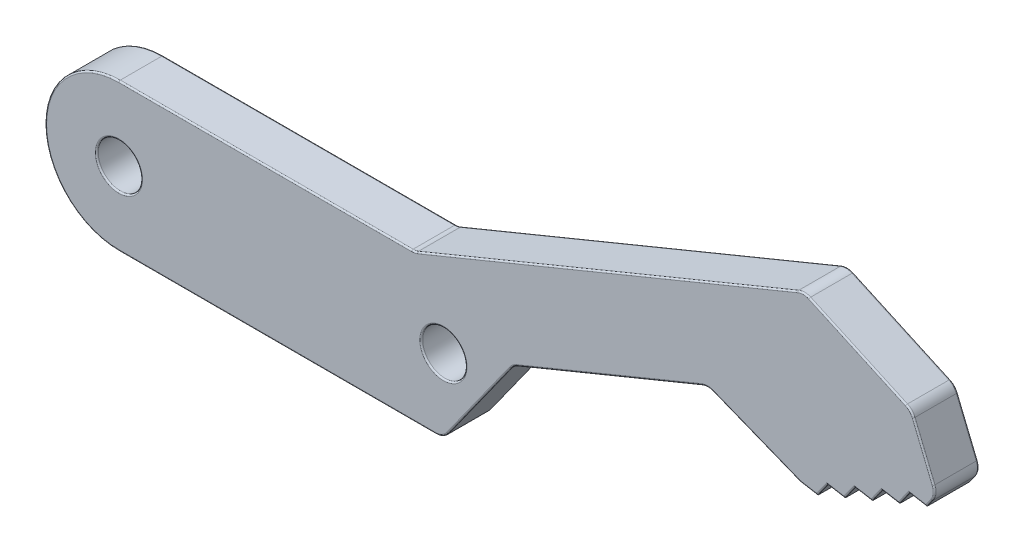
from build123d import *

# Parameters (mm, degrees)
SKETCH1_R           = 1.5
BOSS_EXTRUDE1_DEPTH = 3
FILLET1_R           = 1
FILLET2_R           = 0.1


with BuildPart() as part:
    # Sketch1 → Boss-Extrude1 (new body)
    with BuildSketch(Plane.XY):
        with BuildLine():
            Line((20.05, 5), (0, 5))
            ThreePointArc((0, 5), (-5, 0), (0, -5))
            Line((0, -5), (22, -5))
            Line((22, -5), (26.72989842, 1.621129525))
            Line((26.72989842, 1.621129525), (39.900164389, 7.036080522))
            Line((39.900164389, 7.036080522), (46.188488025, 4.540007042))
            Line((46.188488025, 4.540007042), (47.352932204, 4.337597171))
            Line((47.352932204, 4.337597171), (48.038244482, 5.300533868))
            Line((48.038244482, 5.300533868), (49.20268866, 5.098123997))
            Line((49.20268866, 5.098123997), (49.888000938, 6.061060693))
            Line((49.888000938, 6.061060693), (51.052445116, 5.858650822))
            Line((51.052445116, 5.858650822), (51.737757394, 6.821587519))
            Line((51.737757394, 6.821587519), (52.902201573, 6.619177648))
            Line((52.902201573, 6.619177648), (53.587513851, 7.582114344))
            Line((53.587513851, 7.582114344), (54.751958029, 7.379704473))
            Line((54.751958029, 7.379704473), (55.437270307, 8.34264117))
            Line((55.437270307, 8.34264117), (53.72608495, 12.504593197))
            Line((53.72608495, 12.504593197), (46.409029503, 15.837507263))
            Line((46.409029503, 15.837507263), (20.05, 5))
        make_face()
        Circle(SKETCH1_R, mode=Mode.SUBTRACT)
        with Locations((22, 0)):
            Circle(SKETCH1_R, mode=Mode.SUBTRACT)
    extrude(amount=BOSS_EXTRUDE1_DEPTH)

    # Fillet1
    fillet1_edges = [part.edges().sort_by_distance(p)[0] for p in [
        (22, -5, 1.5),
        (20.05, 5, 1.5),
        (46.409029503, 15.837507263, 1.5),
        (53.72608495, 12.504593197, 1.5),
        (55.437270307, 8.34264117, 1.5),
        (46.188488025, 4.540007042, 1.5),
        (39.900164389, 7.036080522, 1.5),
        (26.72989842, 1.621129525, 1.5),
    ]]
    fillet(fillet1_edges, radius=FILLET1_R)

    # Fillet2
    fillet2_edges = [part.edges().sort_by_distance(p)[0] for p in [
        (-5, 0, 3),
        (10.742707502, -5, 3),
        (-1.5, 0, 3),
        (10.742707502, -5, 0),
        (-5, 0, 0),
        (9.926224034, 5, 0),
        (54.934606654, 7.636345233, 0),
        (54.16973594, 7.480909409, 0),
        (53.244857712, 7.100645996, 0),
        (52.319979483, 6.720382583, 0),
        (51.395101255, 6.340119171, 0),
        (50.470223027, 5.959855758, 0),
        (49.545344799, 5.579592345, 0),
        (48.620466571, 5.199328932, 0),
        (47.695588343, 4.81906552, 0),
        (-1.5, 0, 0),
        (20.5, 0, 0),
        (47.695588343, 4.81906552, 3),
        (48.620466571, 5.199328932, 3),
        (49.545344799, 5.579592345, 3),
        (50.470223027, 5.959855758, 3),
        (51.395101255, 6.340119171, 3),
        (52.319979483, 6.720382583, 3),
        (46.821569256, 4.429961501, 0),
        (46.821569256, 4.429961501, 3),
        (24.430868365, -1.597158571, 0),
        (33.120567207, 10.373959881, 0),
        (50.084671969, 14.163254475, 0),
        (53.244857712, 7.100645996, 3),
        (54.551946118, 10.495930284, 0),
        (43.184108162, 5.732559038, 0),
        (33.261273822, 4.306502609, 0),
        (21.942973456, -4.889179544, 0),
        (46.407353605, 15.747745513, 0),
        (20.5, 0, 3),
        (53.671796386, 12.452294668, 0),
        (55.296006271, 8.358847414, 0),
        (46.189931352, 4.545122826, 0),
        (54.16973594, 7.480909409, 3),
        (43.184108162, 5.732559038, 3),
        (24.430868365, -1.597158571, 3),
        (33.261273822, 4.306502609, 3),
        (54.551946118, 10.495930284, 3),
        (50.084671969, 14.163254475, 3),
        (33.120567207, 10.373959881, 3),
        (54.934606654, 7.636345233, 3),
        (21.942973456, -4.889179544, 3),
        (46.407353605, 15.747745513, 3),
        (53.671796386, 12.452294668, 3),
        (55.296006271, 8.358847414, 3),
        (46.189931352, 4.545122826, 3),
        (20.046254378, 5.018960187, 0),
        (20.046254378, 5.018960187, 3),
        (26.755110061, 1.589325677, 0),
        (26.755110061, 1.589325677, 3),
        (39.900644128, 6.957547244, 0),
        (39.900644128, 6.957547244, 3),
        (9.926224034, 5, 3),
    ]]
    fillet(fillet2_edges, radius=FILLET2_R)


solid = part.part
